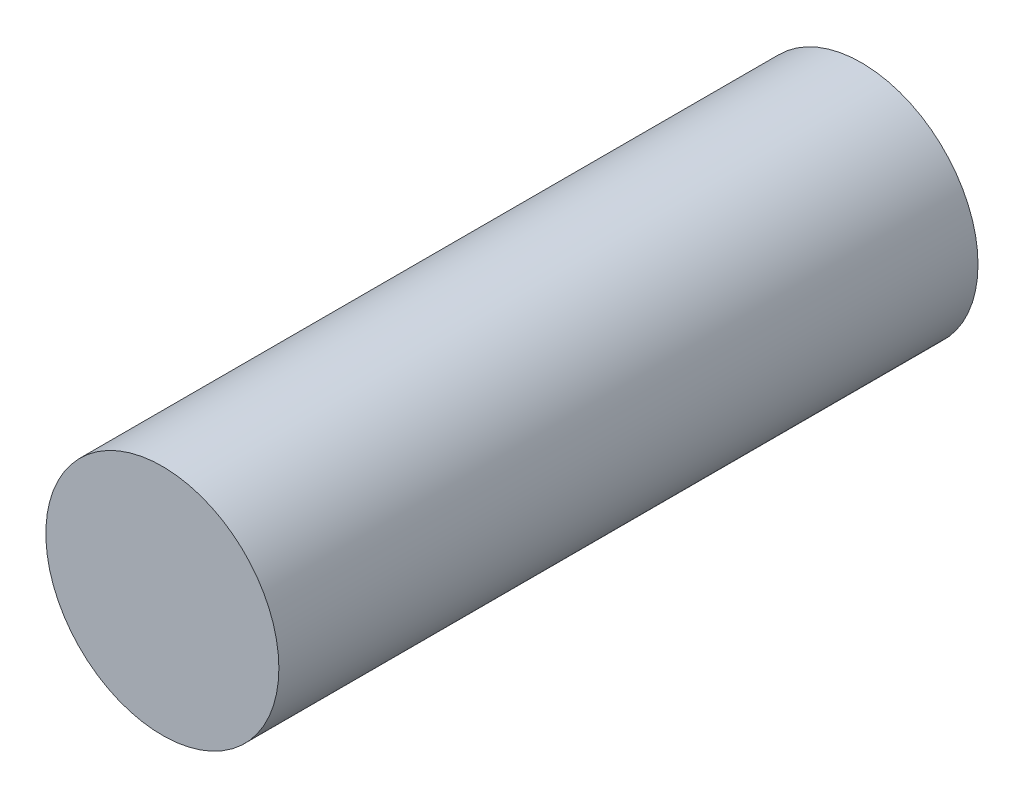
from build123d import *

# Parameters (mm, degrees)
ESBO_O1_R                = 3
RESSALTO_EXTRUS_O1_DEPTH = 18


with BuildPart() as part:
    # Esboço1 → Ressalto-extrusão1 (new body)
    with BuildSketch(Plane.XY):
        Circle(ESBO_O1_R)
    extrude(amount=RESSALTO_EXTRUS_O1_DEPTH)


solid = part.part
